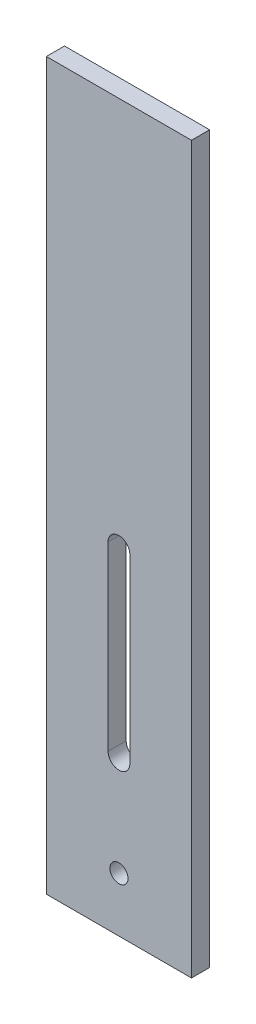
from build123d import *

# Parameters (mm, degrees)
SKETCH1_W           = 40
SKETCH1_H           = 200
SKETCH1_R           = 2.5
BOSS_EXTRUDE1_DEPTH = 5


with BuildPart() as part:
    # Sketch1 → Boss-Extrude1 (new body)
    with BuildSketch(Plane.XY):
        with Locations((-20, -100)):
            Rectangle(SKETCH1_W, SKETCH1_H)
        with Locations((-20, -185)):
            Circle(SKETCH1_R, mode=Mode.SUBTRACT)
        with BuildLine():
            Line((-17, -107.376368338), (-17, -157.376368338))
            ThreePointArc((-17, -157.376368338), (-20, -160.376368338), (-23, -157.376368338))
            Line((-23, -157.376368338), (-23, -107.376368338))
            ThreePointArc((-23, -107.376368338), (-20, -104.376368338), (-17, -107.376368338))
        make_face(mode=Mode.SUBTRACT)
    extrude(amount=BOSS_EXTRUDE1_DEPTH)


solid = part.part
